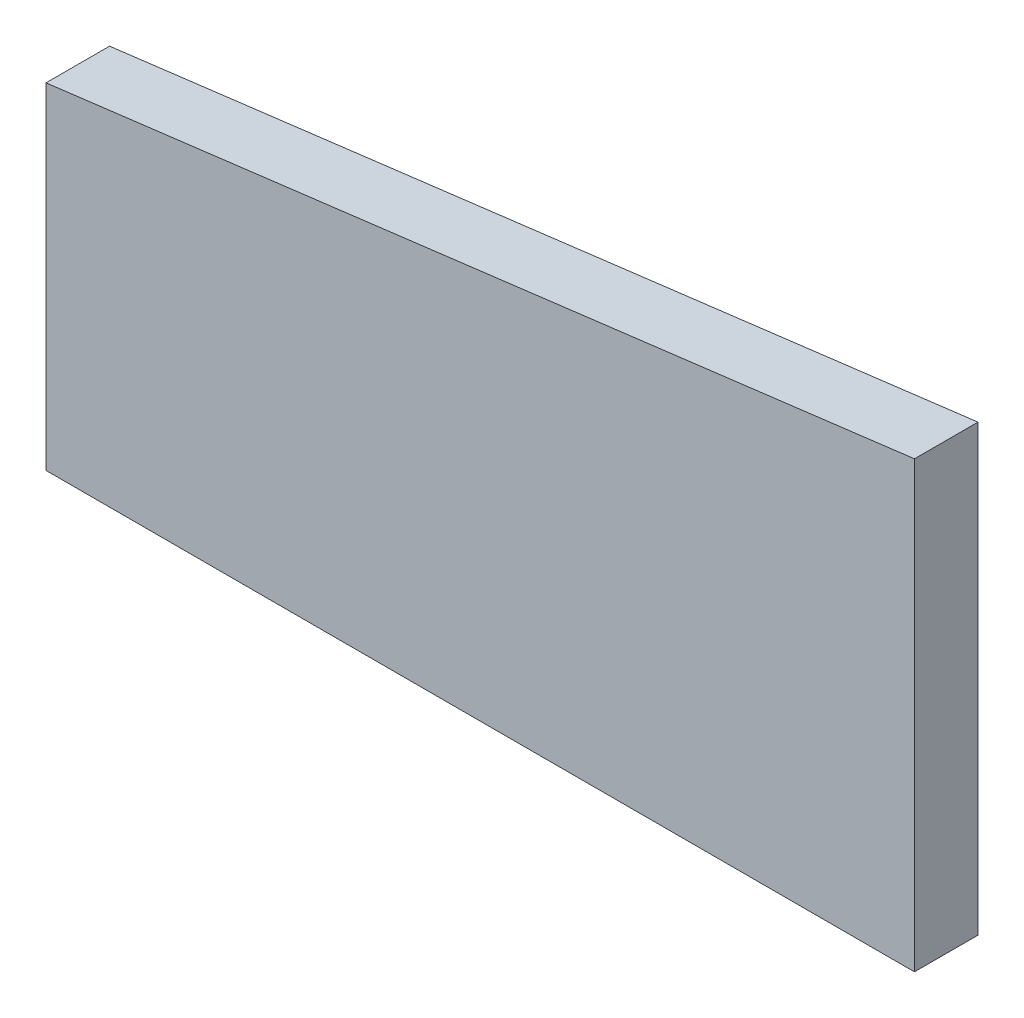
from build123d import *

# Parameters (mm, degrees)
BOSS_EXTRUDE3_DEPTH = 19.05


with BuildPart() as part:
    # Sketch5 → Boss-Extrude3 (new body)
    with BuildSketch(Plane.XY):
        Polygon((226.436295427, 127.831059213), (226.436295427, 27.19467147), (486.786295427, 27.19467147), (486.786295427, 160.396225774), align=None)
    extrude(amount=BOSS_EXTRUDE3_DEPTH)


solid = part.part
